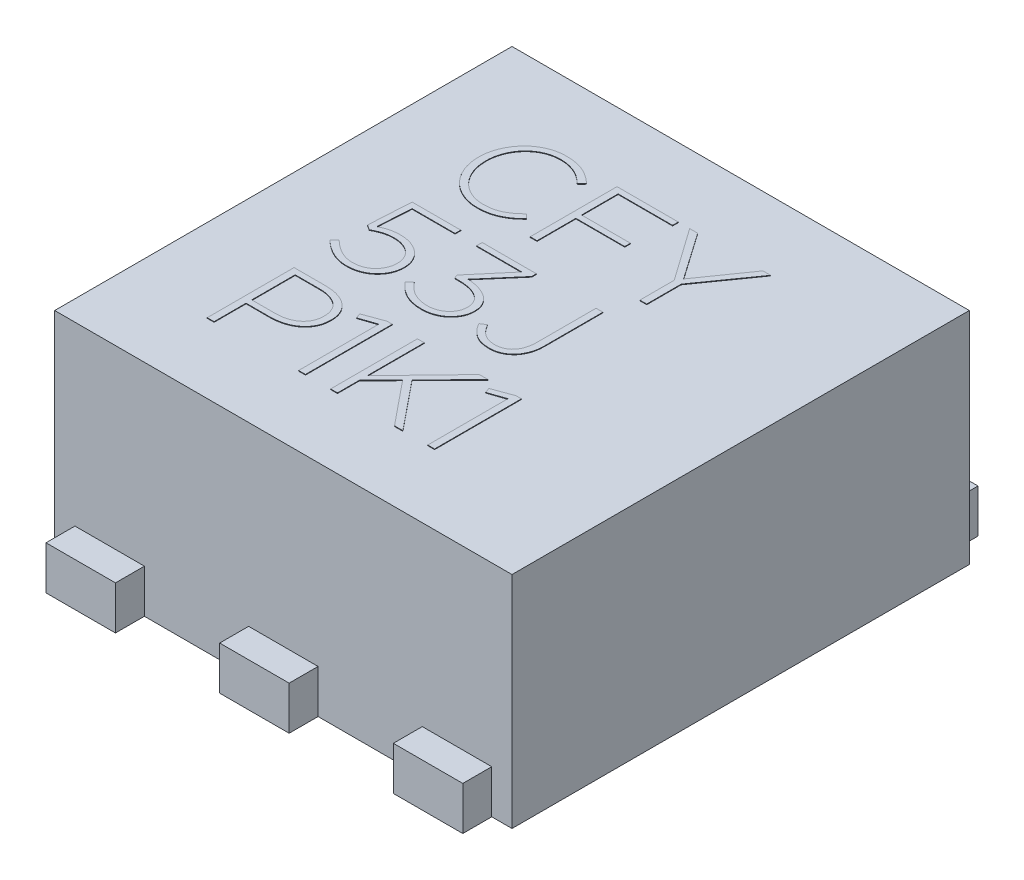
from build123d import *

# Parameters (mm, degrees)
SKETCH1_W           = 2.0066
SKETCH1_H           = 2.0066
BOSS_EXTRUDE1_DEPTH = 0.9652
SKETCH2_W           = 0.3048
SKETCH2_H           = 0.1905
BOSS_EXTRUDE2_DEPTH = 0.127
BOSS_EXTRUDE3_DEPTH = 0.00254


with BuildPart() as part:
    # Sketch1 → Boss-Extrude1 (new body)
    with BuildSketch(Plane(origin=(0, 0, 0), x_dir=(1, 0, 0), z_dir=(0, 1, 0))):
        Rectangle(SKETCH1_W, SKETCH1_H)
    extrude(amount=BOSS_EXTRUDE1_DEPTH)

    # Sketch2 → Boss-Extrude2 (add)
    with BuildSketch(Plane.XY.offset(1.0033)):
        with Locations((0, 0.09525)):
            Rectangle(SKETCH2_W, SKETCH2_H)
        with Locations((0.762, 0.09525)):
            Rectangle(SKETCH2_W, SKETCH2_H)
        with Locations((-0.762, 0.09525)):
            Rectangle(SKETCH2_W, SKETCH2_H)
    boss_extrude2 = extrude(amount=BOSS_EXTRUDE2_DEPTH)

    # Mirror1: Boss-Extrude2 across plane
    add(boss_extrude2.mirror(Plane.XY))

    # Sketch3 → Boss-Extrude3 (add)
    # profile 1 of 10: a face of its own
    with BuildSketch(Plane(origin=(0, 0.9652, 0), x_dir=(1, 0, 0), z_dir=(0, 1, 0))):
        with BuildLine():
            add(Edge.make_bspline(
                [(-0.464544831, 0.312486842), (-0.47118658, 0.312664102), (-0.484296317, 0.313013983), (-0.503603384, 0.315896447), (-0.522147148, 0.320696003), (-0.539865412, 0.327265195), (-0.556557197, 0.335542631), (-0.572220339, 0.345145759), (-0.586606337, 0.356311402), (-0.599912455, 0.368661064), (-0.611818726, 0.382442838), (-0.622445415, 0.39739078), (-0.631708037, 0.413532663), (-0.639595033, 0.430721899), (-0.645979183, 0.448819741), (-0.650501432, 0.467636343), (-0.653232108, 0.487084039), (-0.653603358, 0.500236481), (-0.653791542, 0.506903372)],
                knots=[0, 0, 0, 0, 1.054195513, 2.080811273, 3.09136329, 4.090928071, 5.075437235, 6.045312843, 7.0030623, 7.962201522, 8.923166792, 9.889447214, 10.870064349, 11.873653196, 12.888490594, 13.912113605, 14.941663336, 16, 16, 16, 16], degree=3))
            Line((-0.653791542, 0.506903372), (-0.653791542, 0.508))
            add(Edge.make_bspline(
                [(-0.653791542, 0.508), (-0.65360893, 0.514589217), (-0.653247896, 0.527616477), (-0.650423123, 0.546882755), (-0.645787805, 0.565580273), (-0.639388318, 0.583662599), (-0.631252202, 0.600830861), (-0.622016987, 0.617121212), (-0.61121909, 0.632137296), (-0.599355248, 0.646164932), (-0.586086419, 0.658818371), (-0.571699435, 0.670226277), (-0.556013349, 0.679983999), (-0.539322947, 0.688413277), (-0.521596255, 0.695178922), (-0.502952555, 0.700021685), (-0.483467342, 0.703015498), (-0.470195468, 0.703345426), (-0.463448203, 0.703513158)],
                knots=[0, 0, 0, 0, 1.041832373, 2.059762397, 3.072350947, 4.084602614, 5.087749651, 6.073758899, 7.042027807, 8.008630923, 8.975383991, 9.937007889, 10.907467045, 11.891814537, 12.890386669, 13.902031662, 14.933417564, 16, 16, 16, 16], degree=3))
            add(Edge.make_bspline(
                [(-0.463448203, 0.703513158), (-0.459294629, 0.703486762), (-0.451212766, 0.703435401), (-0.439403827, 0.702495747), (-0.428203674, 0.70123103), (-0.417570226, 0.699312969), (-0.407423021, 0.69697057), (-0.397674928, 0.69413042), (-0.388293967, 0.690882446), (-0.376372321, 0.685814091), (-0.36211645, 0.678539097), (-0.346083324, 0.66801878), (-0.33071367, 0.656309115), (-0.321064534, 0.647652857), (-0.31618669, 0.643276933)],
                knots=[0, 0, 0, 0, 0.914254497, 1.778920911, 2.606817561, 3.395102384, 4.156514643, 4.898826745, 5.629742143, 6.340854795, 7.749865447, 9.146767208, 10.55762974, 12, 12, 12, 12], degree=3))
            Line((-0.31618669, 0.643276933), (-0.336239322, 0.622754317))
            add(Edge.make_bspline(
                [(-0.336239322, 0.622754317), (-0.340420228, 0.626648844), (-0.348762029, 0.634419256), (-0.362101769, 0.645026252), (-0.376015816, 0.654791847), (-0.391173429, 0.662789344), (-0.407423538, 0.669423841), (-0.421870983, 0.673633071), (-0.434073763, 0.676148649), (-0.443734551, 0.677426118), (-0.453743053, 0.678361109), (-0.460547679, 0.678418354), (-0.463996517, 0.678447368)],
                knots=[0, 0, 0, 0, 1.196272513, 2.386819074, 3.566920493, 4.751031721, 5.967618357, 7.237862974, 7.896368677, 8.575399611, 9.277959423, 10, 10, 10, 10], degree=3))
            add(Edge.make_bspline(
                [(-0.463996517, 0.678447368), (-0.46959344, 0.678308271), (-0.480632778, 0.678033916), (-0.496883551, 0.675508995), (-0.512525388, 0.67148012), (-0.527429439, 0.665700741), (-0.541533407, 0.658571122), (-0.554758111, 0.650180494), (-0.566965748, 0.640465722), (-0.578175721, 0.629580115), (-0.58826963, 0.617546274), (-0.597347195, 0.604577915), (-0.605196225, 0.590557351), (-0.61180983, 0.575633619), (-0.617217762, 0.559936247), (-0.620904294, 0.543515042), (-0.62326642, 0.526502326), (-0.623562467, 0.514953248), (-0.623712595, 0.509096628)],
                knots=[0, 0, 0, 0, 1.034860358, 2.041152744, 3.034703784, 4.017914397, 4.992208653, 5.954356592, 6.910190429, 7.873513869, 8.840222493, 9.811746631, 10.797978486, 11.807847073, 12.828266177, 13.864129433, 14.916884699, 16, 16, 16, 16], degree=3))
            Line((-0.623712595, 0.509096628), (-0.623712595, 0.508))
            add(Edge.make_bspline(
                [(-0.623712595, 0.508), (-0.623568758, 0.502142579), (-0.623284395, 0.49056251), (-0.620817829, 0.473501498), (-0.617064834, 0.456965342), (-0.611509647, 0.441164956), (-0.604721418, 0.4261581), (-0.596767344, 0.412062022), (-0.587774344, 0.398939422), (-0.577623543, 0.386890992), (-0.566396074, 0.376005416), (-0.554215121, 0.366210003), (-0.540987485, 0.357744725), (-0.526884979, 0.350533378), (-0.511980077, 0.344684673), (-0.496347224, 0.340543616), (-0.480080866, 0.338070125), (-0.469044334, 0.337726744), (-0.463448203, 0.337552632)],
                knots=[0, 0, 0, 0, 1.079242995, 2.133653515, 3.171588202, 4.200589649, 5.215182267, 6.204443786, 7.180407667, 8.143660157, 9.103539566, 10.058955548, 11.020257913, 11.99325002, 12.97468206, 13.965908815, 14.968603549, 16, 16, 16, 16], degree=3))
            add(Edge.make_bspline(
                [(-0.463448203, 0.337552632), (-0.460078775, 0.337596796), (-0.45343683, 0.337683854), (-0.443657855, 0.338399956), (-0.434193908, 0.339579077), (-0.425087904, 0.341197338), (-0.416289533, 0.343317351), (-0.407885685, 0.345995201), (-0.39976138, 0.349040115), (-0.389319322, 0.353801361), (-0.376645894, 0.361076353), (-0.36170992, 0.371189672), (-0.347021309, 0.383076402), (-0.337717133, 0.391975462), (-0.332949437, 0.396535567)],
                knots=[0, 0, 0, 0, 0.822135291, 1.620624348, 2.391144691, 3.148513217, 3.876362449, 4.597769171, 5.299493563, 5.99236891, 7.395933389, 8.859155827, 10.390551289, 12, 12, 12, 12], degree=3))
            Line((-0.332949437, 0.396535567), (-0.314071764, 0.378127878))
            add(Edge.make_bspline(
                [(-0.314071764, 0.378127878), (-0.319145626, 0.373431873), (-0.329190873, 0.364134706), (-0.344885183, 0.351162338), (-0.361525836, 0.33982611), (-0.376267505, 0.331932345), (-0.388565285, 0.32644717), (-0.398234121, 0.322986656), (-0.408220584, 0.31979677), (-0.418628109, 0.317148976), (-0.42944893, 0.315018046), (-0.44072393, 0.313533641), (-0.452468574, 0.312680736), (-0.460470251, 0.312552263), (-0.464544831, 0.312486842)],
                knots=[0, 0, 0, 0, 1.473488271, 2.917216759, 4.335764993, 5.757540972, 6.475182698, 7.204086771, 7.945106539, 8.709093146, 9.491664519, 10.294494744, 11.131529659, 12, 12, 12, 12], degree=3))
        make_face()
    # profile 2 of 10: a face of its own
    with BuildSketch(Plane(origin=(0, 0.9652, 0), x_dir=(1, 0, 0), z_dir=(0, 1, 0))):
        Polygon((-0.237699437, 0.6985), (0.031131155, 0.6985), (0.031131155, 0.673434211), (-0.207620489, 0.673434211), (-0.207620489, 0.513013158), (0.006770341, 0.513013158), (0.006770341, 0.487947368), (-0.207620489, 0.487947368), (-0.207620489, 0.3175), (-0.237699437, 0.3175), align=None)
    # profile 3 of 10: a face of its own
    with BuildSketch(Plane(origin=(0, 0.9652, 0), x_dir=(1, 0, 0), z_dir=(0, 1, 0))):
        Polygon((0.243563721, 0.46828639), (0.081106073, 0.6985), (0.116276509, 0.6985), (0.259151509, 0.493822163), (0.402496493, 0.6985), (0.436100317, 0.6985), (0.273642669, 0.468834704), (0.273642669, 0.3175), (0.243563721, 0.3175), align=None)
    # profile 4 of 10: a face of its own
    with BuildSketch(Plane(origin=(0, 0.9652, 0), x_dir=(1, 0, 0), z_dir=(0, 1, 0))):
        with BuildLine():
            add(Edge.make_bspline(
                [(-0.531125835, -0.195513158), (-0.537537087, -0.195306795), (-0.550236621, -0.194898029), (-0.568998634, -0.191480812), (-0.587155414, -0.185903841), (-0.604574667, -0.178169505), (-0.621038884, -0.168845975), (-0.636497663, -0.158515693), (-0.650803048, -0.147218044), (-0.659444697, -0.13887503), (-0.663739527, -0.134728618)],
                knots=[0, 0, 0, 0, 1.027091986, 2.034483686, 3.045944865, 4.065436139, 5.082966719, 6.075467794, 7.043522885, 8, 8, 8, 8], degree=3))
            Line((-0.663739527, -0.134728618), (-0.643686896, -0.114675987))
            add(Edge.make_bspline(
                [(-0.643686896, -0.114675987), (-0.639365928, -0.118848986), (-0.630874661, -0.127049475), (-0.617239948, -0.137877922), (-0.603441634, -0.147548404), (-0.589288474, -0.155701191), (-0.574858039, -0.162322665), (-0.560091222, -0.166930551), (-0.545135922, -0.169907839), (-0.535056017, -0.170267838), (-0.530029206, -0.170447368)],
                knots=[0, 0, 0, 0, 1.109179193, 2.17968211, 3.212685538, 4.219648281, 5.193340946, 6.139214123, 7.072032972, 8, 8, 8, 8], degree=3))
            add(Edge.make_bspline(
                [(-0.530029206, -0.170447368), (-0.526317661, -0.17035328), (-0.519026926, -0.170168458), (-0.508349849, -0.168828735), (-0.498186742, -0.166578776), (-0.488609277, -0.163326194), (-0.479607518, -0.159356706), (-0.471252495, -0.1546473), (-0.463602611, -0.14919492), (-0.456612322, -0.14308776), (-0.450345746, -0.13629598), (-0.444686628, -0.129041338), (-0.439786409, -0.121190922), (-0.435627889, -0.112836331), (-0.432369459, -0.103975035), (-0.429894009, -0.094786487), (-0.428468183, -0.085242346), (-0.428289695, -0.07877906), (-0.428199437, -0.075510691)],
                knots=[0, 0, 0, 0, 1.145346535, 2.249849336, 3.315357495, 4.352544201, 5.366331399, 6.347897687, 7.307179358, 8.260859585, 9.207397063, 10.155202969, 11.096546173, 12.058801949, 13.030293121, 14.005687019, 14.991511462, 16, 16, 16, 16], degree=3))
            Line((-0.428199437, -0.075510691), (-0.428199437, -0.074492393))
            add(Edge.make_bspline(
                [(-0.428199437, -0.074492393), (-0.428288782, -0.071302157), (-0.428464713, -0.065020174), (-0.429887033, -0.055785678), (-0.432355585, -0.046981913), (-0.435639315, -0.038571992), (-0.439788931, -0.030618304), (-0.444853866, -0.023265765), (-0.450564095, -0.016382456), (-0.457139079, -0.010198358), (-0.464356333, -0.00453242), (-0.472295857, 0.00050284), (-0.480978377, 0.004803308), (-0.490261225, 0.008446033), (-0.500065145, 0.011465275), (-0.510374329, 0.013553147), (-0.521118737, 0.014839916), (-0.528432808, 0.014972299), (-0.532144132, 0.015039474)],
                knots=[0, 0, 0, 0, 0.997445971, 1.964098809, 2.913068328, 3.851722655, 4.783138491, 5.711758029, 6.63915603, 7.574857543, 8.528837996, 9.505237224, 10.509512245, 11.554302971, 12.621166842, 13.713386878, 14.839721157, 16, 16, 16, 16], degree=3))
            add(Edge.make_bspline(
                [(-0.532144132, 0.015039474), (-0.53645468, 0.014937647), (-0.544833358, 0.014739719), (-0.557058923, 0.013540196), (-0.568499299, 0.011246651), (-0.582591227, 0.007151344), (-0.59908778, 0.000705762), (-0.611541151, -0.005642896), (-0.617681139, -0.008773026)],
                knots=[0, 0, 0, 0, 0.864106721, 1.679617632, 2.458643664, 3.199094088, 4.619046371, 6, 6, 6, 6], degree=3))
            Line((-0.617681139, -0.008773026), (-0.639378713, 0.00524815))
            Line((-0.639378713, 0.00524815), (-0.628569091, 0.1905))
            Line((-0.628569091, 0.1905), (-0.41535322, 0.1905))
            Line((-0.41535322, 0.1905), (-0.41535322, 0.165434211))
            Line((-0.41535322, 0.165434211), (-0.603659963, 0.165434211))
            Line((-0.603659963, 0.165434211), (-0.612824642, 0.01981764))
            add(Edge.make_bspline(
                [(-0.612824642, 0.01981764), (-0.606660606, 0.022681965), (-0.594374578, 0.028391078), (-0.578163509, 0.033733558), (-0.564596006, 0.037217102), (-0.553461874, 0.03880577), (-0.541491234, 0.039994358), (-0.533218113, 0.040067418), (-0.528932578, 0.040105263)],
                knots=[0, 0, 0, 0, 1.402637683, 2.795707893, 3.517593015, 4.292393027, 5.115447508, 6, 6, 6, 6], degree=3))
            add(Edge.make_bspline(
                [(-0.528932578, 0.040105263), (-0.524410651, 0.039998069), (-0.515496028, 0.039786745), (-0.502398586, 0.038171329), (-0.489795257, 0.035643919), (-0.477807797, 0.031883923), (-0.466374466, 0.027413001), (-0.455679548, 0.021955985), (-0.44568221, 0.015761172), (-0.436422936, 0.008769284), (-0.42788242, 0.001058577), (-0.42047201, -0.007664611), (-0.413797716, -0.016984632), (-0.408288953, -0.02714094), (-0.403655588, -0.037845923), (-0.400493288, -0.049231965), (-0.398440302, -0.061127754), (-0.398228262, -0.069261595), (-0.398120489, -0.073395765)],
                knots=[0, 0, 0, 0, 1.123273924, 2.214445758, 3.274310636, 4.312692179, 5.33188634, 6.321261941, 7.291587211, 8.25045863, 9.200953541, 10.143890608, 11.088878704, 12.044166038, 13.009337543, 13.980681618, 14.973645425, 16, 16, 16, 16], degree=3))
            Line((-0.398120489, -0.073395765), (-0.398120489, -0.074492393))
            add(Edge.make_bspline(
                [(-0.398120489, -0.074492393), (-0.398227833, -0.078887113), (-0.398438532, -0.087513268), (-0.400482978, -0.100112964), (-0.403655626, -0.112143417), (-0.408265848, -0.123460183), (-0.413794803, -0.134175948), (-0.420456066, -0.144056185), (-0.427914972, -0.153321052), (-0.436376611, -0.161738006), (-0.445662626, -0.169366498), (-0.455730311, -0.17616777), (-0.466689943, -0.181925364), (-0.478319111, -0.186897992), (-0.490696368, -0.190701244), (-0.503628863, -0.193548055), (-0.517191926, -0.195208091), (-0.526421491, -0.195410162), (-0.531125835, -0.195513158)],
                knots=[0, 0, 0, 0, 1.04914212, 2.05930394, 3.041340515, 4.015500302, 4.972493289, 5.917106832, 6.857219733, 7.80995437, 8.762791105, 9.724711486, 10.706985765, 11.716087755, 12.742015645, 13.795469643, 14.876342745, 16, 16, 16, 16], degree=3))
        make_face()
    # profile 5 of 10: a face of its own
    with BuildSketch(Plane(origin=(0, 0.9652, 0), x_dir=(1, 0, 0), z_dir=(0, 1, 0))):
        with BuildLine():
            add(Edge.make_bspline(
                [(-0.201510703, -0.195513158), (-0.205324187, -0.195446725), (-0.212856392, -0.19531551), (-0.223975745, -0.19446328), (-0.234720177, -0.1929624), (-0.245078704, -0.190932414), (-0.255082083, -0.188351332), (-0.264720998, -0.185150753), (-0.273973559, -0.181296912), (-0.285718373, -0.175458763), (-0.299522772, -0.167019449), (-0.31477387, -0.155396036), (-0.328650264, -0.142337314), (-0.33667889, -0.132573902), (-0.340704165, -0.127678865)],
                knots=[0, 0, 0, 0, 0.854125718, 1.687026974, 2.495868605, 3.282634088, 4.049990918, 4.808201546, 5.555394222, 6.292912602, 7.744166783, 9.171122272, 10.581698634, 12, 12, 12, 12], degree=3))
            Line((-0.340704165, -0.127678865), (-0.319006591, -0.10981949))
            add(Edge.make_bspline(
                [(-0.319006591, -0.10981949), (-0.315184589, -0.114500025), (-0.307692255, -0.123675355), (-0.295023864, -0.13577055), (-0.281681135, -0.146271273), (-0.267496725, -0.155094747), (-0.252301972, -0.161957623), (-0.236130746, -0.166932202), (-0.218875159, -0.169857931), (-0.207031222, -0.170247667), (-0.200962389, -0.170447368)],
                knots=[0, 0, 0, 0, 1.051504755, 2.061282292, 3.042744266, 4.004328949, 4.962812362, 5.937986947, 6.943424556, 8, 8, 8, 8], degree=3))
            add(Edge.make_bspline(
                [(-0.200962389, -0.170447368), (-0.19785097, -0.170376201), (-0.191684014, -0.170235145), (-0.182549504, -0.168979236), (-0.173620724, -0.167161526), (-0.164989607, -0.164450208), (-0.15673021, -0.161157416), (-0.149041957, -0.157072043), (-0.141770532, -0.152679735), (-0.135182339, -0.14751936), (-0.129120284, -0.141888026), (-0.123664834, -0.135655273), (-0.118911857, -0.128840069), (-0.114785504, -0.121518751), (-0.111501239, -0.113660948), (-0.109047238, -0.105346144), (-0.107617199, -0.096552648), (-0.107445129, -0.090555351), (-0.107357331, -0.087495271)],
                knots=[0, 0, 0, 0, 1.071432388, 2.123621283, 3.171610268, 4.207327115, 5.236341997, 6.230152734, 7.203726503, 8.159177883, 9.107488144, 10.051050515, 11.006882949, 11.965378523, 12.941069526, 13.934554503, 14.94612047, 16, 16, 16, 16], degree=3))
            Line((-0.107357331, -0.087495271), (-0.107357331, -0.086398643))
            add(Edge.make_bspline(
                [(-0.107357331, -0.086398643), (-0.107457995, -0.083180028), (-0.107654176, -0.076907317), (-0.109318077, -0.067803511), (-0.112147873, -0.059336417), (-0.116139883, -0.051531635), (-0.121019609, -0.044259283), (-0.126872728, -0.03761883), (-0.133470264, -0.031449206), (-0.140959658, -0.025968659), (-0.149235621, -0.021143121), (-0.158182916, -0.01677758), (-0.167963473, -0.01321011), (-0.178419243, -0.010268872), (-0.189464737, -0.007935331), (-0.200996175, -0.006207187), (-0.213006042, -0.00516938), (-0.221169614, -0.005065839), (-0.225323203, -0.005013158)],
                knots=[0, 0, 0, 0, 0.963608797, 1.87796242, 2.760967906, 3.628456335, 4.496191556, 5.377671509, 6.274255881, 7.197233316, 8.150982903, 9.140989963, 10.175448806, 11.264866304, 12.392392662, 13.554967256, 14.755978196, 16, 16, 16, 16], degree=3))
            Line((-0.225323203, -0.005013158), (-0.245924149, -0.005013158))
            Line((-0.245924149, -0.005013158), (-0.252973902, 0.011122944))
            Line((-0.252973902, 0.011122944), (-0.122475136, 0.165434211))
            Line((-0.122475136, 0.165434211), (-0.321199848, 0.165434211))
            Line((-0.321199848, 0.165434211), (-0.321199848, 0.1905))
            Line((-0.321199848, 0.1905), (-0.08338817, 0.1905))
            Line((-0.08338817, 0.1905), (-0.08338817, 0.170055715))
            Line((-0.08338817, 0.170055715), (-0.212398655, 0.020052632))
            add(Edge.make_bspline(
                [(-0.212398655, 0.020052632), (-0.207927179, 0.019749718), (-0.199084464, 0.019150681), (-0.186053853, 0.017167695), (-0.173316942, 0.014738328), (-0.161019303, 0.011406336), (-0.149180747, 0.007601521), (-0.138123809, 0.002825558), (-0.127693938, -0.002461448), (-0.118068355, -0.008603151), (-0.109151324, -0.015354901), (-0.101272062, -0.023060183), (-0.094235782, -0.031475001), (-0.088176959, -0.040722628), (-0.083297578, -0.050790961), (-0.07969252, -0.061674278), (-0.077691887, -0.073400247), (-0.077418282, -0.081482667), (-0.077278384, -0.085615337)],
                knots=[0, 0, 0, 0, 1.128632186, 2.231963543, 3.318219822, 4.393666515, 5.440010544, 6.448018481, 7.424783858, 8.382874731, 9.32099772, 10.237444474, 11.152970021, 12.079839814, 13.015422399, 13.964003957, 14.958962976, 16, 16, 16, 16], degree=3))
            Line((-0.077278384, -0.085615337), (-0.077278384, -0.086633635))
            add(Edge.make_bspline(
                [(-0.077278384, -0.086633635), (-0.077386187, -0.090637456), (-0.077598215, -0.098512236), (-0.079649389, -0.110020234), (-0.08282218, -0.121012859), (-0.087418277, -0.131323638), (-0.093004507, -0.140979494), (-0.099473326, -0.149991761), (-0.106833518, -0.158273569), (-0.115014582, -0.16583919), (-0.123975224, -0.172545164), (-0.13355795, -0.178565445), (-0.14387817, -0.183618683), (-0.154729741, -0.18794789), (-0.166043769, -0.191269162), (-0.17764215, -0.193713809), (-0.189483908, -0.195266332), (-0.197485, -0.195430538), (-0.201510703, -0.195513158)],
                knots=[0, 0, 0, 0, 1.044842178, 2.0550125, 3.043330542, 4.026600455, 4.995144434, 5.952823185, 6.919011366, 7.884236345, 8.85809585, 9.838333897, 10.835646202, 11.855097055, 12.886521583, 13.911069267, 14.948966669, 16, 16, 16, 16], degree=3))
        make_face()
    # profile 6 of 10: a face of its own
    with BuildSketch(Plane(origin=(0, 0.9652, 0), x_dir=(1, 0, 0), z_dir=(0, 1, 0))):
        with BuildLine():
            add(Edge.make_bspline(
                [(0.094500604, -0.195513158), (0.091051513, -0.195457804), (0.084296728, -0.195349397), (0.074411843, -0.194359936), (0.06497934, -0.192918075), (0.055998464, -0.190785453), (0.047451045, -0.188059895), (0.039348176, -0.184687611), (0.031734512, -0.180677779), (0.022217982, -0.174584904), (0.011219894, -0.165749899), (-0.000621713, -0.153583434), (-0.011357203, -0.140059927), (-0.017259895, -0.130078274), (-0.020253713, -0.125015625)],
                knots=[0, 0, 0, 0, 0.873059519, 1.70982136, 2.513030241, 3.28753981, 4.044382626, 4.782277978, 5.506784192, 6.220196106, 7.640880388, 9.066738992, 10.512263439, 12, 12, 12, 12], degree=3))
            Line((-0.020253713, -0.125015625), (0.003010473, -0.110367804))
            add(Edge.make_bspline(
                [(0.003010473, -0.110367804), (0.005892446, -0.115008339), (0.011469663, -0.12398874), (0.020688964, -0.136297305), (0.030588743, -0.146887709), (0.041407538, -0.155586227), (0.05328625, -0.162226014), (0.063934281, -0.166299416), (0.07303905, -0.168436663), (0.080368302, -0.169608522), (0.088115629, -0.170319152), (0.093428561, -0.170403985), (0.096145547, -0.170447368)],
                knots=[0, 0, 0, 0, 1.398728133, 2.706830051, 3.93204539, 5.102849771, 6.246739065, 7.404386305, 8.009418439, 8.639401413, 9.304202199, 10, 10, 10, 10], degree=3))
            add(Edge.make_bspline(
                [(0.096145547, -0.170447368), (0.098996713, -0.170382081), (0.104623202, -0.170253244), (0.112910511, -0.168926222), (0.120917403, -0.16690895), (0.128650885, -0.164079026), (0.135995276, -0.16042087), (0.14283061, -0.155919099), (0.149190452, -0.150696831), (0.154981672, -0.144636699), (0.160234611, -0.137809863), (0.164891124, -0.130189488), (0.168955414, -0.121830992), (0.172318811, -0.112637553), (0.175063601, -0.102717212), (0.176995182, -0.091995296), (0.17818345, -0.080550793), (0.17832166, -0.07266769), (0.178392669, -0.068617599)],
                knots=[0, 0, 0, 0, 0.927828857, 1.830976465, 2.726041962, 3.613807302, 4.507457995, 5.39187773, 6.273759435, 7.181857147, 8.115589863, 9.073744259, 10.085345118, 11.137310876, 12.257482928, 13.433301287, 14.681310717, 16, 16, 16, 16], degree=3))
            Line((0.178392669, -0.068617599), (0.178392669, 0.1905))
            Line((0.178392669, 0.1905), (0.208471616, 0.1905))
            Line((0.208471616, 0.1905), (0.208471616, -0.06611102))
            add(Edge.make_bspline(
                [(0.208471616, -0.06611102), (0.208357221, -0.071469149), (0.208134934, -0.081880831), (0.206243758, -0.097022248), (0.203053282, -0.111136539), (0.198650892, -0.124189207), (0.193266162, -0.136133385), (0.186933683, -0.146884314), (0.180040935, -0.156669075), (0.174627885, -0.162284732), (0.17196956, -0.165042558)],
                knots=[0, 0, 0, 0, 1.187280689, 2.307071812, 3.37545062, 4.389319271, 5.35536709, 6.273492655, 7.152119696, 8, 8, 8, 8], degree=3))
            add(Edge.make_bspline(
                [(0.17196956, -0.165042558), (0.16938205, -0.167476958), (0.164247741, -0.172307458), (0.15570497, -0.178491562), (0.146641099, -0.183796183), (0.137022879, -0.188092816), (0.126920604, -0.191354037), (0.116479951, -0.193827494), (0.105610527, -0.19524576), (0.098238357, -0.195423196), (0.094500604, -0.195513158)],
                knots=[0, 0, 0, 0, 0.996723719, 1.97776543, 2.953560524, 3.941400224, 4.929076667, 5.930320209, 6.950655008, 8, 8, 8, 8], degree=3))
        make_face()
    # profile 7 of 10: a face of its own
    with BuildSketch(Plane(origin=(0, 0.9652, 0), x_dir=(1, 0, 0), z_dir=(0, 1, 0))):
        with BuildLine():
            Line((-0.638752068, -0.3175), (-0.50002859, -0.3175))
            add(Edge.make_bspline(
                [(-0.50002859, -0.3175), (-0.494855006, -0.317580565), (-0.484720386, -0.317738385), (-0.46990032, -0.319256691), (-0.455801612, -0.321731229), (-0.442490697, -0.325291622), (-0.429923082, -0.329605425), (-0.418278828, -0.334985589), (-0.407458414, -0.341164014), (-0.397599544, -0.348324192), (-0.388592262, -0.356217552), (-0.380699189, -0.365054529), (-0.373957995, -0.374768177), (-0.36818723, -0.385212632), (-0.363624516, -0.396488703), (-0.360325088, -0.408574409), (-0.358340836, -0.421457188), (-0.358125307, -0.430315065), (-0.358015226, -0.434839227)],
                knots=[0, 0, 0, 0, 1.196921679, 2.344669652, 3.443385774, 4.505952197, 5.530222051, 6.514354356, 7.469914615, 8.40903817, 9.329312154, 10.23654073, 11.143386922, 12.060103376, 12.992516311, 13.951185394, 14.953567577, 16, 16, 16, 16], degree=3))
            Line((-0.358015226, -0.434839227), (-0.358015226, -0.435935855))
            add(Edge.make_bspline(
                [(-0.358015226, -0.435935855), (-0.358172271, -0.440800314), (-0.358478736, -0.450293077), (-0.360676937, -0.464114697), (-0.36444451, -0.477063924), (-0.369731575, -0.489082716), (-0.376254578, -0.500140206), (-0.383854496, -0.510273671), (-0.392474577, -0.519470847), (-0.402192162, -0.527631384), (-0.412770703, -0.534846968), (-0.42424495, -0.541038657), (-0.436459992, -0.54639821), (-0.449491604, -0.550645041), (-0.46305123, -0.554018887), (-0.477096983, -0.556313128), (-0.491480638, -0.557893373), (-0.501225322, -0.558051736), (-0.506138376, -0.558131579)],
                knots=[0, 0, 0, 0, 1.082547061, 2.112539734, 3.105652367, 4.076371558, 5.027263717, 5.957144052, 6.890450641, 7.826575801, 8.776028277, 9.735689167, 10.724712095, 11.741037828, 12.782704211, 13.831785834, 14.906834304, 16, 16, 16, 16], degree=3))
            Line((-0.506138376, -0.558131579), (-0.608673121, -0.558131579))
            Line((-0.608673121, -0.558131579), (-0.608673121, -0.6985))
            Line((-0.608673121, -0.6985), (-0.638752068, -0.6985))
            Line((-0.638752068, -0.6985), (-0.638752068, -0.3175))
        make_face()
        with BuildLine():
            add(Edge.make_bspline(
                [(-0.50535507, -0.533065789), (-0.501069915, -0.532998811), (-0.492663176, -0.532867412), (-0.480353985, -0.531594855), (-0.468651041, -0.52948541), (-0.457572339, -0.526582926), (-0.447155841, -0.522972109), (-0.437567412, -0.518417926), (-0.428634206, -0.51340529), (-0.420612763, -0.50742889), (-0.413279959, -0.500880012), (-0.406842743, -0.493548304), (-0.401248506, -0.485591488), (-0.396514174, -0.477015532), (-0.392770814, -0.467839792), (-0.38998204, -0.458162221), (-0.388422537, -0.447971127), (-0.388204895, -0.441032409), (-0.388094174, -0.437502467)],
                knots=[0, 0, 0, 0, 1.210317823, 2.3744361, 3.491443017, 4.566752069, 5.607291514, 6.600610338, 7.562226251, 8.496140603, 9.420567993, 10.335172103, 11.245871006, 12.163682178, 13.096547188, 14.039881934, 15.002826692, 16, 16, 16, 16], degree=3))
            Line((-0.388094174, -0.437502467), (-0.388094174, -0.436405839))
            add(Edge.make_bspline(
                [(-0.388094174, -0.436405839), (-0.38819793, -0.43263978), (-0.388399904, -0.425308715), (-0.390010732, -0.414678258), (-0.392523353, -0.404732465), (-0.396292686, -0.395608004), (-0.400822691, -0.387132626), (-0.406339967, -0.379456461), (-0.412663887, -0.372478973), (-0.419841565, -0.366282888), (-0.427785846, -0.360792861), (-0.436486807, -0.356004505), (-0.445877414, -0.351834314), (-0.456022078, -0.348506252), (-0.466760978, -0.345862661), (-0.478059344, -0.343871006), (-0.489929424, -0.342807634), (-0.498016178, -0.342647513), (-0.502143516, -0.342565789)],
                knots=[0, 0, 0, 0, 1.082715527, 2.107629682, 3.08580406, 4.025753622, 4.939784489, 5.844231746, 6.737383951, 7.64239226, 8.565265821, 9.509884037, 10.495067623, 11.516260569, 12.576340263, 13.673955534, 14.812827606, 16, 16, 16, 16], degree=3))
            Line((-0.502143516, -0.342565789), (-0.608673121, -0.342565789))
            Line((-0.608673121, -0.342565789), (-0.608673121, -0.533065789))
            Line((-0.608673121, -0.533065789), (-0.50535507, -0.533065789))
        make_face(mode=Mode.SUBTRACT)
    # profile 8 of 10: a face of its own
    with BuildSketch(Plane(origin=(0, 0.9652, 0), x_dir=(1, 0, 0), z_dir=(0, 1, 0))):
        Polygon((-0.237699437, -0.346717311), (-0.310781879, -0.371626439), (-0.318379947, -0.349458882), (-0.231197998, -0.3175), (-0.207620489, -0.3175), (-0.207620489, -0.6985), (-0.237699437, -0.6985), align=None)
    # profile 9 of 10: a face of its own
    with BuildSketch(Plane(origin=(0, 0.9652, 0), x_dir=(1, 0, 0), z_dir=(0, 1, 0))):
        Polygon((-0.097331016, -0.3175), (-0.067252068, -0.3175), (-0.067252068, -0.567844572), (0.174241147, -0.3175), (0.212701468, -0.3175), (0.047032266, -0.485675781), (0.219751221, -0.6985), (0.182935843, -0.6985), (0.026979634, -0.506825041), (-0.067252068, -0.602153372), (-0.067252068, -0.6985), (-0.097331016, -0.6985), align=None)
    # profile 10 of 10: a face of its own
    with BuildSketch(Plane(origin=(0, 0.9652, 0), x_dir=(1, 0, 0), z_dir=(0, 1, 0))):
        Polygon((0.328787405, -0.346717311), (0.255704963, -0.371626439), (0.248106896, -0.349458882), (0.335288845, -0.3175), (0.358866353, -0.3175), (0.358866353, -0.6985), (0.328787405, -0.6985), align=None)
    extrude(amount=BOSS_EXTRUDE3_DEPTH)


solid = part.part
